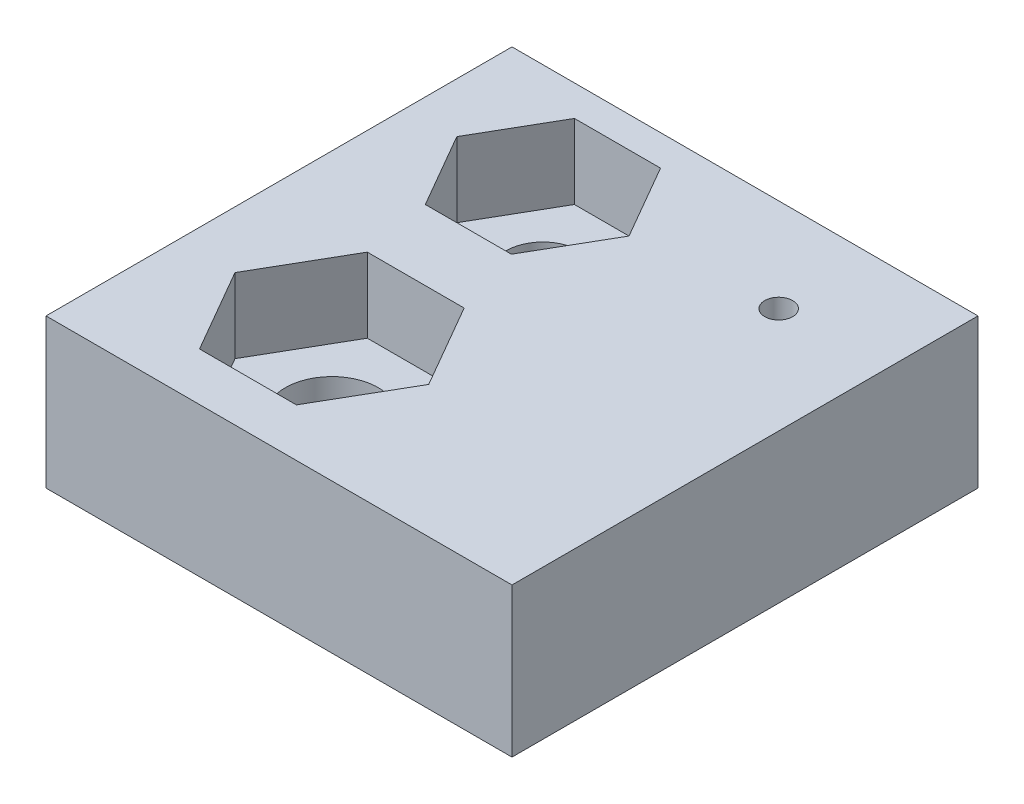
from build123d import *

# Parameters (mm, degrees)
SKETCH1_W           = 25
SKETCH1_H           = 25
BOSS_EXTRUDE1_DEPTH = 8
SKETCH2_R           = 2
SKETCH2_R_2         = 0.75
SKETCH2_R_3         = 2.5
CUT_EXTRUDE1_DEPTH  = 8
CUT_EXTRUDE2_DEPTH  = 4


with BuildPart() as part:
    # Sketch1 → Boss-Extrude1 (new body)
    with BuildSketch(Plane(origin=(0, 0, 0), x_dir=(1, 0, 0), z_dir=(0, 1, 0))):
        Rectangle(SKETCH1_W, SKETCH1_H)
    extrude(amount=BOSS_EXTRUDE1_DEPTH)

    # Sketch2 → Cut-Extrude1 (cut)
    with BuildSketch(Plane(origin=(0, 8, 0), x_dir=(1, 0, 0), z_dir=(0, 1, 0))):
        with Locations(Location((-5.191248411, 6.850045341, 0), (0, 0, 270))):
            Circle(SKETCH2_R)
        with Locations(Location((6.814693369, 7.491872418, 0), (0, 0, 270))):
            Circle(SKETCH2_R_2)
        with Locations(Location((-4.247385064, -5.417775614, 0), (0, 0, 270))):
            Circle(SKETCH2_R_3)
    extrude(amount=-CUT_EXTRUDE1_DEPTH, mode=Mode.SUBTRACT)

    # Sketch3 → Cut-Extrude2 (cut)
    with BuildSketch(Plane(origin=(0, 8, 0), x_dir=(1, 0, 0), z_dir=(0, 1, 0))):
        Polygon((-0.572446257, 6.850045341), (-2.881847334, 10.850045341), (-7.500649488, 10.850045341), (-9.810050565, 6.850045341), (-7.500649488, 2.850045341), (-2.881847334, 2.850045341), align=None)
        Polygon((0.948767359, -5.417775614), (-1.649308852, -0.917775614), (-6.845461275, -0.917775614), (-9.443537486, -5.417775614), (-6.845461275, -9.917775614), (-1.649308852, -9.917775614), align=None)
    extrude(amount=-CUT_EXTRUDE2_DEPTH, mode=Mode.SUBTRACT)


solid = part.part
